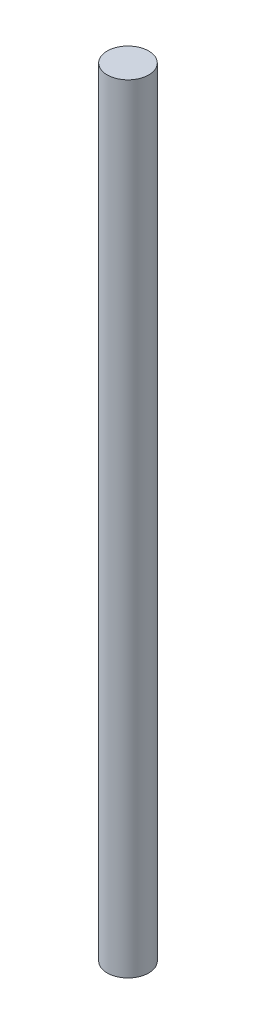
from build123d import *

# Parameters (mm, degrees)
ESQUISSE1_R        = 4
BOSS_EXTRU_1_DEPTH = 150


with BuildPart() as part:
    # Esquisse1 → Boss.-Extru.1 (new body)
    with BuildSketch(Plane(origin=(0, 0, 0), x_dir=(-1, 0, 0), z_dir=(0, 1, 0))):
        with Locations(Location((0, 0, 0), (0, 0, 90))):
            Circle(ESQUISSE1_R)
    extrude(amount=BOSS_EXTRU_1_DEPTH)


solid = part.part
